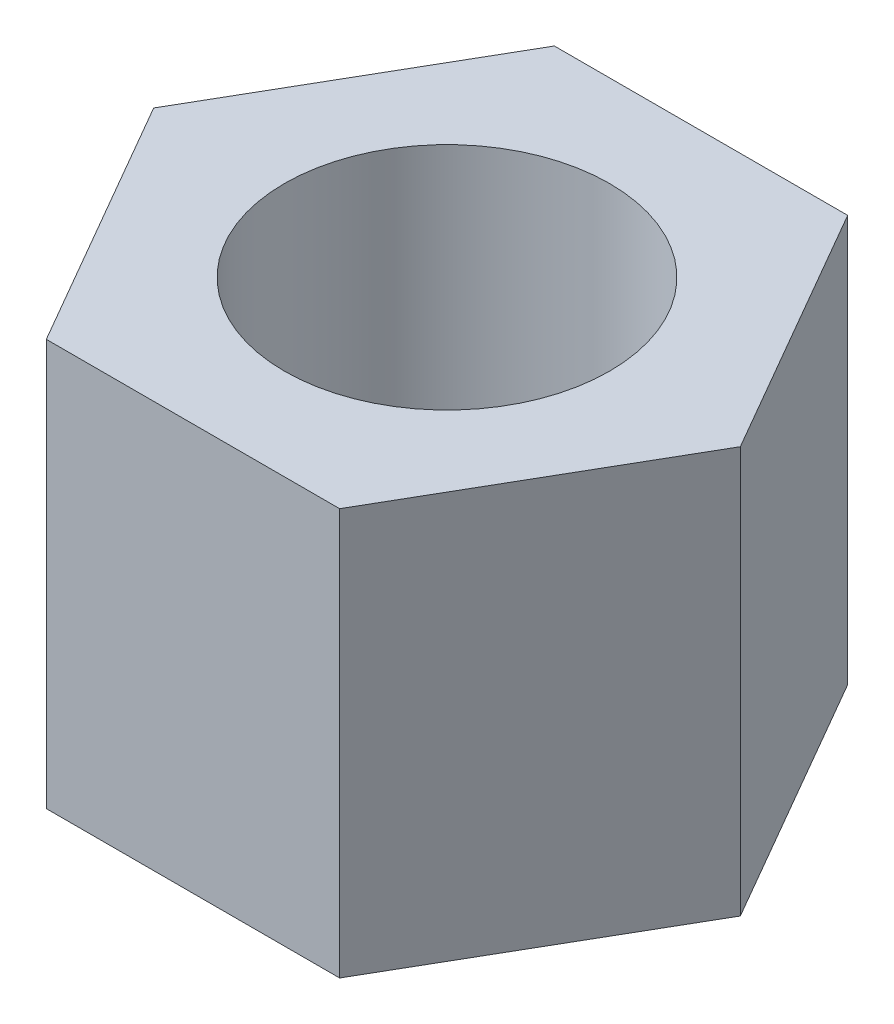
from build123d import *

# Parameters (mm, degrees)
SKETCH_1_R      = 1.6
EXTRUDE_1_DEPTH = 2


with BuildPart() as part:
    # 草图1 → 凸台-拉伸1 (new, symmetric)
    with BuildSketch(Plane(origin=(0, 0, 0), x_dir=(1, 0, 0), z_dir=(0, 1, 0))):
        Polygon((2.886751346, 0), (1.443375673, 2.5), (-1.443375673, 2.5), (-2.886751346, 0), (-1.443375673, -2.5), (1.443375673, -2.5), align=None)
        with Locations(Location((0, 0, 0), (0, 0, 270))):
            Circle(SKETCH_1_R, mode=Mode.SUBTRACT)
    extrude(amount=EXTRUDE_1_DEPTH, both=True)


solid = part.part
